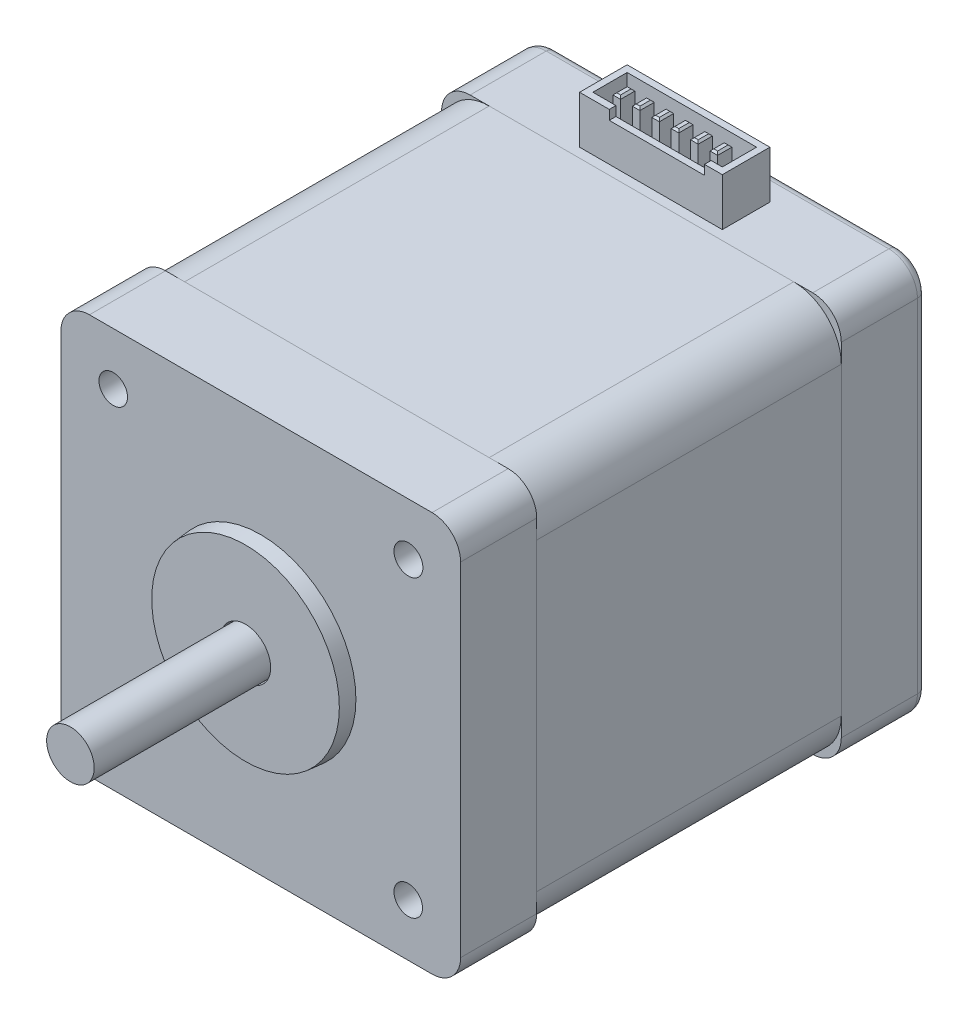
from build123d import *

# Parameters (mm, degrees)
SKETCH_1_R          = 1.5
EXTRUDE_1_DEPTH     = 8
SKETCH_4_R          = 2.5
EXTRUDE_2_DEPTH     = 20
SKETCH_9_W          = 42
SKETCH_9_H          = 42
EXTRUDE_7_DEPTH     = 32
SKETCH_10_W         = 42
SKETCH_10_H         = 42
EXTRUDE_8_DEPTH     = 9
FILLET_1_R          = 3
FILLET_2_R          = 5
SKETCH_12_R         = 1.5
SKETCH_12_R_2       = 1.518540069
CUT_EXTRUDE_1_DEPTH = 58.297469403
SKETCH_14_W         = 15
SKETCH_14_H         = 5
SKETCH_14_W_2       = 13.6
SKETCH_14_H_2       = 3.6
SKETCH_14_W_3       = 0.8
SKETCH_14_H_3       = 1.5
EXTRUDE_10_DEPTH    = 5
CHAMFER_1_SIZE      = 0.2
SKETCH_15_W         = 10
SKETCH_15_H         = 1
CUT_EXTRUDE_2_DEPTH = 0.7
FILLET_3_R          = 1
SKETCH_16_R         = 10
SKETCH_16_R_2       = 2.5
EXTRUDE_11_DEPTH    = 1.6
EXTRUDE_11_DRAFT    = 5
SKETCH_18_R         = 5
CUT_EXTRUDE_3_DEPTH = 3
EXTRUDE_START       = 2
SKETCH_19_R         = 2.5
EXTRUDE_13_DEPTH    = 2


with BuildPart() as part:
    # 草图1 → 凸台-拉伸1 (new body)
    with BuildSketch(Plane.XY):
        with BuildLine():
            Line((-18, 21), (18, 21))
            ThreePointArc((18, 21), (20.121320344, 20.121320344), (21, 18))
            Line((21, 18), (21, -18))
            ThreePointArc((21, -18), (20.121320344, -20.121320344), (18, -21))
            Line((18, -21), (-18, -21))
            ThreePointArc((-18, -21), (-20.121320344, -20.121320344), (-21, -18))
            Line((-21, -18), (-21, 18))
            ThreePointArc((-21, 18), (-20.121320344, 20.121320344), (-18, 21))
        make_face()
        with Locations((-15.5, 15.5)):
            Circle(SKETCH_1_R, mode=Mode.SUBTRACT)
        with Locations(Location((15.5, 15.5, 0), (0, 0, 180))):
            Circle(SKETCH_1_R, mode=Mode.SUBTRACT)
        with Locations((15.5, -15.5)):
            Circle(SKETCH_1_R, mode=Mode.SUBTRACT)
        with Locations(Location((-15.5, -15.5, 0), (0, 0, 180))):
            Circle(SKETCH_1_R, mode=Mode.SUBTRACT)
    extrude(amount=EXTRUDE_1_DEPTH)

    # 草图4 → 凸台-拉伸2 (add)
    with BuildSketch(Plane.XY.offset(8)):
        with Locations(Location((0, 0, 0), (0, 0, 180))):
            Circle(SKETCH_4_R)
    extrude(amount=EXTRUDE_2_DEPTH)


with BuildPart() as body_2:
    # 草图9 → 凸台-拉伸7 (new body)
    with BuildSketch(Plane(origin=(0, 0, 0), x_dir=(-1, 0, 0), z_dir=(0, 0, -1))):
        Rectangle(SKETCH_9_W, SKETCH_9_H)
    extrude(amount=EXTRUDE_7_DEPTH)

    # 圆角2
    fillet_2_edges = [body_2.edges().sort_by_distance(p)[0] for p in [
        (-21, -21, -16),
        (21, -21, -16),
        (21, 21, -16),
        (-21, 21, -16),
    ]]
    fillet(fillet_2_edges, radius=FILLET_2_R)


with BuildPart() as body_3:
    # 草图10 → 凸台-拉伸8 (new body)
    with BuildSketch(Plane(origin=(0, 0, -32), x_dir=(-1, 0, 0), z_dir=(0, 0, -1))):
        Rectangle(SKETCH_10_W, SKETCH_10_H)
    extrude(amount=EXTRUDE_8_DEPTH)

    # 圆角1
    fillet_1_edges = [body_3.edges().sort_by_distance(p)[0] for p in [
        (21, 21, -36.5),
        (-21, 21, -36.5),
        (-21, -21, -36.5),
        (21, -21, -36.5),
    ]]
    fillet(fillet_1_edges, radius=FILLET_1_R)


with BuildPart() as cut_extrude_1_tool:
    # 草图12 → 切除-拉伸1 (new, through all)
    with BuildSketch(Plane.XY.offset(8)):
        with Locations((-15.5, 15.5)):
            Circle(SKETCH_12_R)
        with Locations((15.518540069, 15.5)):
            Circle(SKETCH_12_R_2)
        with Locations((-15.5, -15.5)):
            Circle(SKETCH_12_R)
        with Locations((15.5, -15.5)):
            Circle(SKETCH_12_R)
    extrude(amount=-CUT_EXTRUDE_1_DEPTH)


with BuildPart() as part_1:
    add(part.part)

    # 切除-拉伸1: cut by cut_extrude_1_tool
    add(cut_extrude_1_tool.part, mode=Mode.SUBTRACT)


with BuildPart() as body_2_1:
    add(body_2.part)

    # 切除-拉伸1: cut by cut_extrude_1_tool
    add(cut_extrude_1_tool.part, mode=Mode.SUBTRACT)


with BuildPart() as body_3_1:
    add(body_3.part)

    # 切除-拉伸1: cut by cut_extrude_1_tool
    add(cut_extrude_1_tool.part, mode=Mode.SUBTRACT)

    # 草图14 → 凸台-拉伸10 (add)
    # profile 1 of 7: a face of its own
    with BuildSketch(Plane(origin=(0, 21, 0), x_dir=(1, 0, 0), z_dir=(0, 1, 0))):
        with Locations((0, 35.5)):
            Rectangle(SKETCH_14_W, SKETCH_14_H)
        with Locations((0, 35.5)):
            Rectangle(SKETCH_14_W_2, SKETCH_14_H_2, mode=Mode.SUBTRACT)
    # profile 2 of 7: a face of its own
    with BuildSketch(Plane(origin=(0, 21, 0), x_dir=(1, 0, 0), z_dir=(0, 1, 0))):
        with Locations((-5.3, 35.457329348)):
            Rectangle(SKETCH_14_W_3, SKETCH_14_H_3)
    # profile 3 of 7: a face of its own
    with BuildSketch(Plane(origin=(0, 21, 0), x_dir=(1, 0, 0), z_dir=(0, 1, 0))):
        with Locations((-1.22, 35.457329348)):
            Rectangle(SKETCH_14_W_3, SKETCH_14_H_3)
    # profile 4 of 7: a face of its own
    with BuildSketch(Plane(origin=(0, 21, 0), x_dir=(1, 0, 0), z_dir=(0, 1, 0))):
        with Locations((4.9, 35.457329348)):
            Rectangle(SKETCH_14_W_3, SKETCH_14_H_3)
    # profile 5 of 7: a face of its own
    with BuildSketch(Plane(origin=(0, 21, 0), x_dir=(1, 0, 0), z_dir=(0, 1, 0))):
        with Locations((2.86, 35.457329348)):
            Rectangle(SKETCH_14_W_3, SKETCH_14_H_3)
    # profile 6 of 7: a face of its own
    with BuildSketch(Plane(origin=(0, 21, 0), x_dir=(1, 0, 0), z_dir=(0, 1, 0))):
        with Locations((-3.26, 35.457329348)):
            Rectangle(SKETCH_14_W_3, SKETCH_14_H_3)
    # profile 7 of 7: a face of its own
    with BuildSketch(Plane(origin=(0, 21, 0), x_dir=(1, 0, 0), z_dir=(0, 1, 0))):
        with Locations((0.82, 35.457329348)):
            Rectangle(SKETCH_14_W_3, SKETCH_14_H_3)
    extrude(amount=EXTRUDE_10_DEPTH)

    # 倒角1
    chamfer_1_edges = [body_3_1.edges().sort_by_distance(p)[0] for p in [
        (5.3, 26, -35.457329348),
        (4.9, 26, -36.207329348),
        (4.5, 26, -35.457329348),
        (4.9, 26, -34.707329348),
        (3.26, 26, -35.457329348),
        (2.86, 26, -36.207329348),
        (2.46, 26, -35.457329348),
        (2.86, 26, -34.707329348),
        (-2.86, 26, -35.457329348),
        (-3.26, 26, -36.207329348),
        (-3.66, 26, -35.457329348),
        (-3.26, 26, -34.707329348),
        (1.22, 26, -35.457329348),
        (0.82, 26, -36.207329348),
        (0.42, 26, -35.457329348),
        (0.82, 26, -34.707329348),
        (-4.9, 26, -35.457329348),
        (-5.3, 26, -36.207329348),
        (-5.7, 26, -35.457329348),
        (-5.3, 26, -34.707329348),
        (-0.82, 26, -35.457329348),
        (-1.22, 26, -36.207329348),
        (-1.62, 26, -35.457329348),
        (-1.22, 26, -34.707329348),
    ]]
    chamfer(chamfer_1_edges, length=CHAMFER_1_SIZE)

    # 草图15 → 切除-拉伸2 (cut)
    with BuildSketch(Plane.XY.offset(-33)):
        with Locations((0.62, 25.5)):
            Rectangle(SKETCH_15_W, SKETCH_15_H)
    extrude(amount=-CUT_EXTRUDE_2_DEPTH, mode=Mode.SUBTRACT)

    # 圆角3
    fillet_3_edges = [body_3_1.edges().sort_by_distance(p)[0] for p in [
        (0, -21, -41),
        (21, 0, -41),
        (-21, 0, -41),
        (0, 21, -41),
        (20.121320344, 20.121320344, -41),
        (-20.121320344, 20.121320344, -41),
        (-20.121320344, -20.121320344, -41),
        (20.121320344, -20.121320344, -41),
    ]]
    fillet(fillet_3_edges, radius=FILLET_3_R)

    # 草图18 → 切除-拉伸3 (cut)
    with BuildSketch(Plane(origin=(0, 0, -41), x_dir=(-1, 0, 0), z_dir=(0, 0, -1))):
        Circle(SKETCH_18_R)
    extrude(amount=-CUT_EXTRUDE_3_DEPTH, mode=Mode.SUBTRACT)

    # 草图19 → 凸台-拉伸13 (add)
    with BuildSketch(Plane(origin=(0, 0, -38), x_dir=(-1, 0, 0), z_dir=(0, 0, -1)).offset(EXTRUDE_START)):
        Circle(SKETCH_19_R)
    extrude(amount=-EXTRUDE_13_DEPTH)


with BuildPart() as extrude_11_tool:
    # 草图16 → 凸台-拉伸11 (with draft: the straight prism first)
    with BuildSketch(Plane.XY.offset(8)):
        Circle(SKETCH_16_R)
        Circle(SKETCH_16_R_2, mode=Mode.SUBTRACT)
    extrude(amount=EXTRUDE_11_DEPTH)
    # 凸台-拉伸11: the draft: its side faces are tilted about the plane it starts from
    extrude_11_sides = [extrude_11_tool.faces().sort_by_distance(p)[0] for p in [
        (-10, 0, 8.8),
        (-2.5, 0, 8.8),
    ]]
    draft(extrude_11_sides, Plane.XY.offset(8), EXTRUDE_11_DRAFT)


with BuildPart() as part_2:
    add(part_1.part)

    # 凸台-拉伸11: add extrude_11_tool
    add(extrude_11_tool.part)


solid = Compound([body_2_1.part, body_3_1.part, part_2.part])
